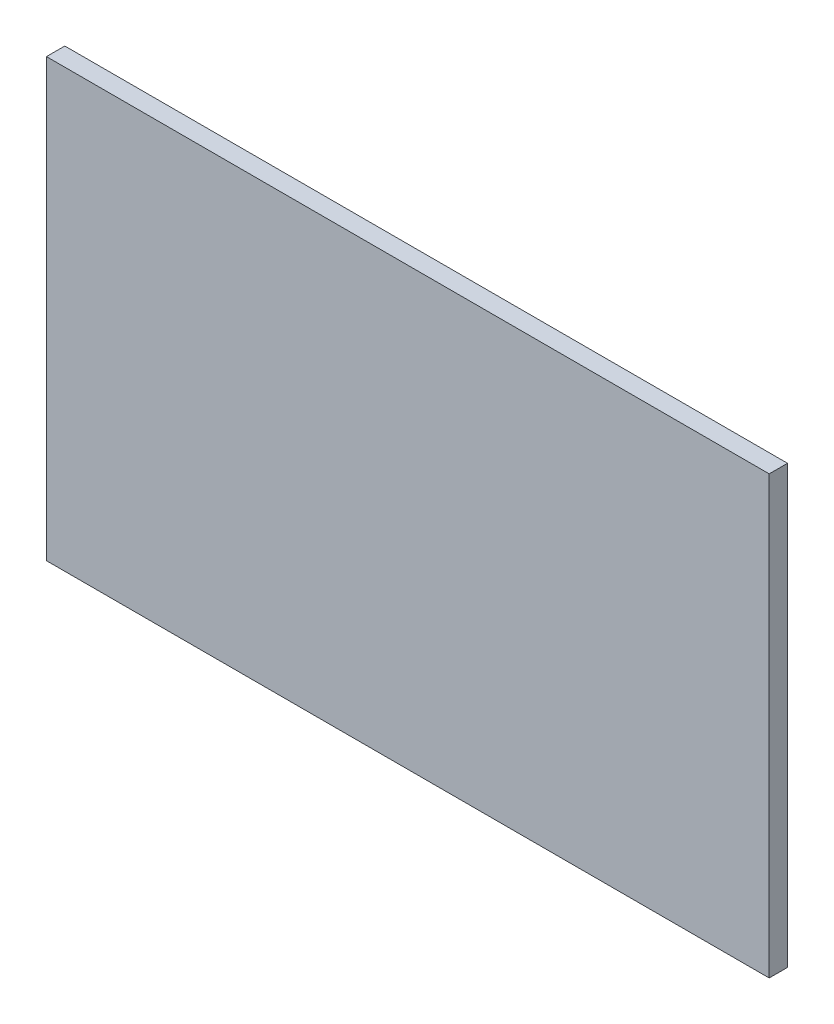
from build123d import *

# Parameters (mm, degrees)
SKETCH1_W             = 180
SKETCH1_H             = 600
BOSS_EXTRUDE1_DEPTH   = 1000
BOSS_EXTRUDE1_2_DEPTH = 1000
SKETCH2_W             = 7881.091222757
SKETCH2_H             = 4760.959600818
BOSS_EXTRUDE2_DEPTH   = 200


with BuildPart() as part:
    # Sketch1 → Boss-Extrude1 (new body)
    with BuildSketch(Plane.XY):
        with Locations((1180.659272875, -4183)):
            Rectangle(SKETCH1_W, SKETCH1_H)
    extrude(amount=BOSS_EXTRUDE1_DEPTH)



with BuildPart() as body_2:
    # Sketch1 → Boss-Extrude1 2 (new body)
    with BuildSketch(Plane.XY):
        with Locations((-259.340727125, -4183)):
            Rectangle(SKETCH1_W, SKETCH1_H)
    extrude(amount=BOSS_EXTRUDE1_2_DEPTH)


with BuildPart() as part_1:
    add(part.part)

    add(body_2.part)  # Boss-Extrude2 merges body 2
    # Sketch2 → Boss-Extrude2 (add)
    with BuildSketch(Plane.XY.offset(1000)):
        with Locations((-453.415513366, -4183)):
            Rectangle(SKETCH2_W, SKETCH2_H)
    extrude(amount=BOSS_EXTRUDE2_DEPTH)


solid = part_1.part
